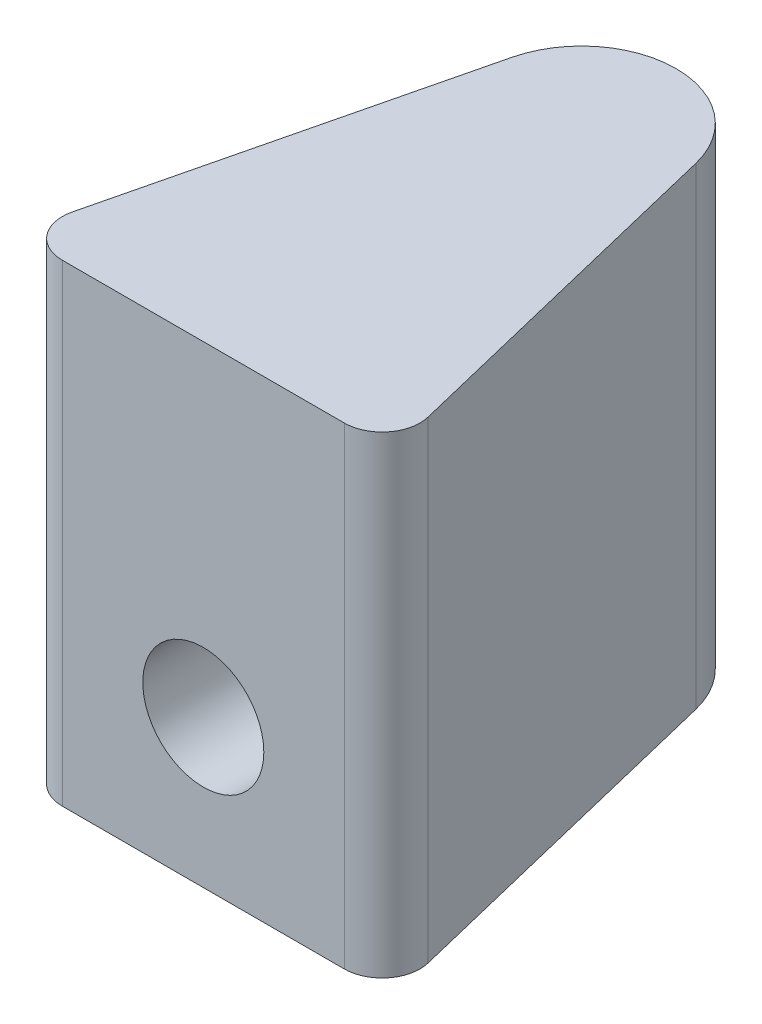
from build123d import *

# Parameters (mm, degrees)
SALIENTE_EXTRUIR1_DEPTH = 25
CROQUIS2_R              = 3.2
CORTAR_EXTRUIR1_DEPTH   = 12
REDONDEO1_R             = 2


with BuildPart() as part:
    # Croquis1 → Saliente-Extruir1 (new body)
    with BuildSketch(Plane(origin=(0, 0, 0), x_dir=(1, 0, 0), z_dir=(0, 1, 0))):
        with BuildLine():
            Line((-4.858898944, 1.179449472), (-10, -20))
            Line((-10, -20), (10, -20))
            Line((10, -20), (4.858898944, 1.179449472))
            ThreePointArc((4.858898944, 1.179449472), (0, 5), (-4.858898944, 1.179449472))
        make_face()
    extrude(amount=SALIENTE_EXTRUIR1_DEPTH)

    # Croquis2 → Cortar-Extruir1 (cut)
    with BuildSketch(Plane.XY.offset(20)):
        with Locations((0, 7.8)):
            Circle(CROQUIS2_R)
    extrude(amount=-CORTAR_EXTRUIR1_DEPTH, mode=Mode.SUBTRACT)

    # Redondeo1
    redondeo1_edges = [part.edges().sort_by_distance(p)[0] for p in [
        (10, 12.5, 20),
        (-10, 12.5, 20),
    ]]
    fillet(redondeo1_edges, radius=REDONDEO1_R)


solid = part.part
